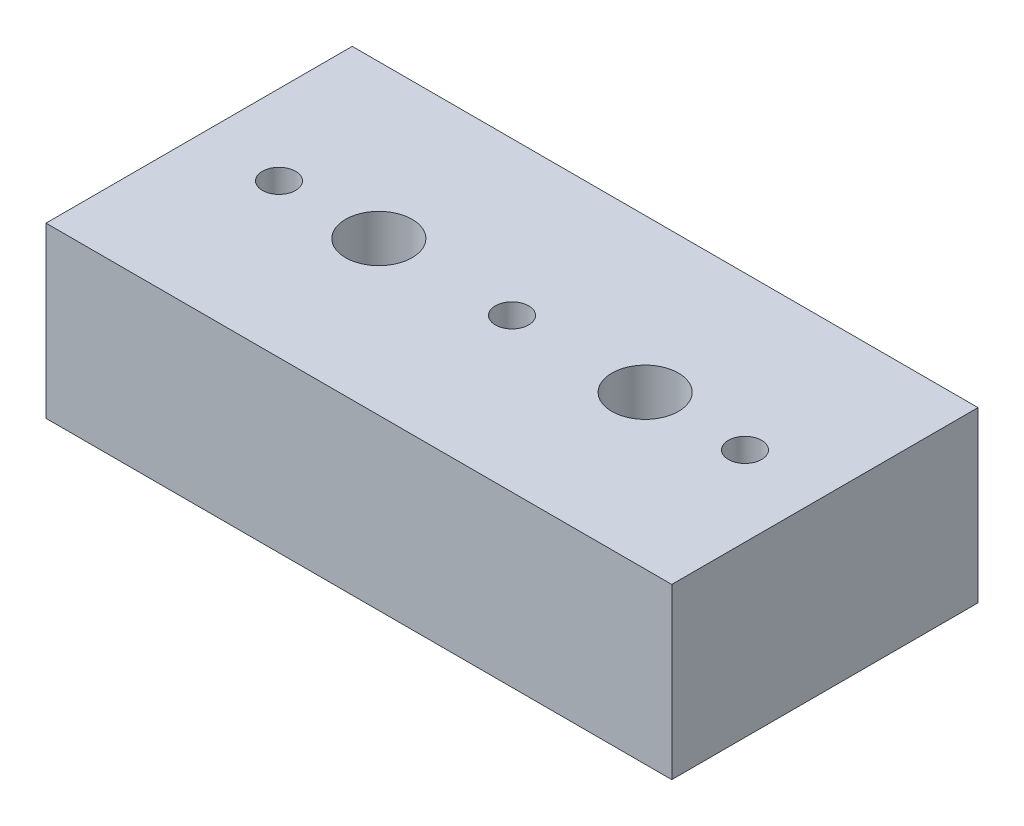
from build123d import *

# Parameters (mm, degrees)
SKETCH1_W           = 47
SKETCH1_H           = 23
SKETCH1_R           = 2.5
SKETCH1_R_2         = 1.25
BOSS_EXTRUDE1_DEPTH = 6.35


with BuildPart() as part:
    # Sketch1 → Boss-Extrude1 (new, symmetric)
    with BuildSketch(Plane(origin=(0, 0, 0), x_dir=(1, 0, 0), z_dir=(0, 1, 0))):
        Rectangle(SKETCH1_W, SKETCH1_H)
        with Locations(Location((-10, 0, 0), (0, 0, 270))):
            Circle(SKETCH1_R, mode=Mode.SUBTRACT)
        with Locations(Location((10, 0, 0), (0, 0, 270))):
            Circle(SKETCH1_R, mode=Mode.SUBTRACT)
        with Locations(Location((17.5, 0, 0), (0, 0, 270))):
            Circle(SKETCH1_R_2, mode=Mode.SUBTRACT)
        with Locations(Location((0, 0, 0), (0, 0, 270))):
            Circle(SKETCH1_R_2, mode=Mode.SUBTRACT)
        with Locations(Location((-17.5, 0, 0), (0, 0, 270))):
            Circle(SKETCH1_R_2, mode=Mode.SUBTRACT)
    extrude(amount=BOSS_EXTRUDE1_DEPTH, both=True)


solid = part.part
